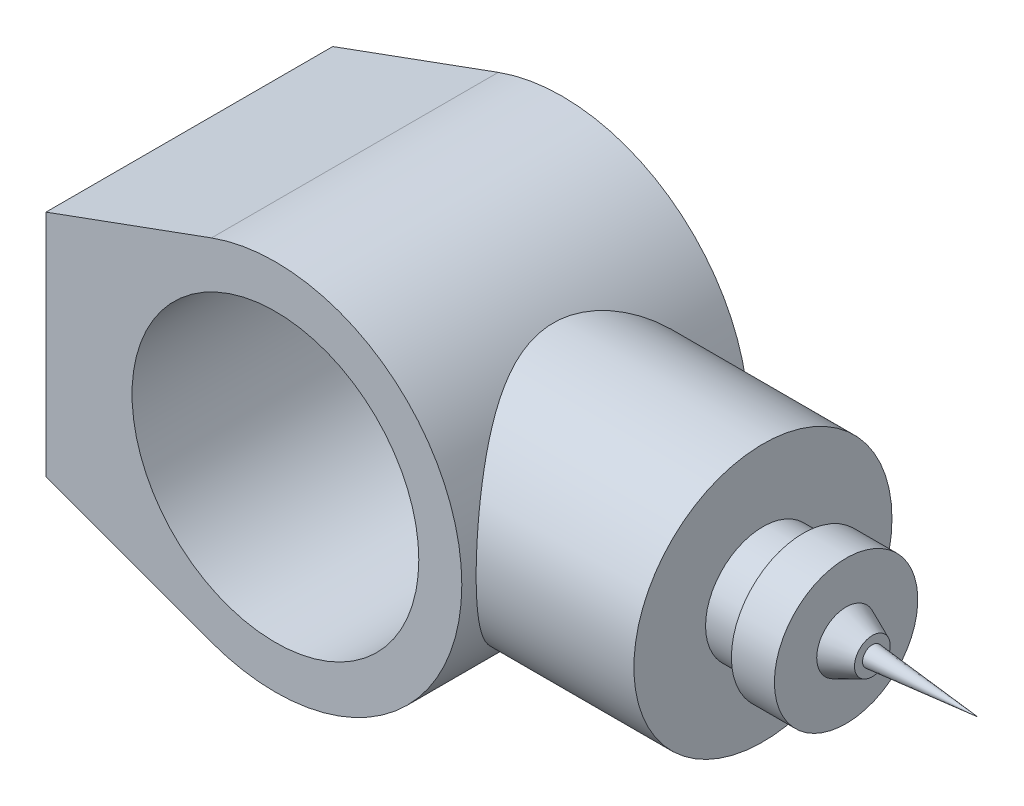
from build123d import *

# Parameters (mm, degrees)
SKETCH1_R                = 50
BOSS_EXTRUDE1_DEPTH      = 50
BOSS_EXTRUDE2_REACH      = 218.16
BOSS_EXTRUDE2_END_RADIUS = 65
SKETCH2_R                = 45


with BuildPart() as part:
    # Sketch1 → Boss-Extrude1 (new, symmetric)
    with BuildSketch(Plane.XY):
        with BuildLine():
            Line((-80, -40), (-80, 40))
            Line((-80, 40), (-22.281665693, 61.061668614))
            ThreePointArc((-22.281665693, 61.061668614), (65, 0), (-22.281665693, -61.061668614))
            Line((-22.281665693, -61.061668614), (-80, -40))
        make_face()
        Circle(SKETCH1_R, mode=Mode.SUBTRACT)
    extrude(amount=BOSS_EXTRUDE1_DEPTH, both=True)

    # Boss-Extrude2: up to this cylinder (the profile starts outside it)
    boss_extrude2_end = Plane(origin=(0, 0, 0), z_dir=(0, 0, -1)) * Cylinder(BOSS_EXTRUDE2_END_RADIUS, 567.32, mode=Mode.PRIVATE)
    # Sketch2 → Boss-Extrude2 (add, up to the surface)
    with BuildSketch(Plane(origin=(120, 0, 0), x_dir=(0, 0, -1), z_dir=(1, 0, 0)), mode=Mode.PRIVATE) as boss_extrude2_sk1:
        Circle(SKETCH2_R)
    boss_extrude2_tool1 = extrude(boss_extrude2_sk1.sketch, amount=-BOSS_EXTRUDE2_REACH, mode=Mode.PRIVATE) - boss_extrude2_end
    add(boss_extrude2_tool1.solids().sort_by_distance((120, 0, 0))[0])

    # Sketch3 → Revolve1 (revolve)
    with BuildSketch(Plane.XY, mode=Mode.PRIVATE) as revolve1_sk:
        Polygon((120, 0), (120, -20), (134, -20), (134, -25), (149, -25), (149, -10.24355852), (158.158462427, -6.228267003), (158.158462427, -3.420688422), (195, 0), align=None)
    revolve(revolve1_sk.sketch.rotate(Axis((0, 0, 0), (1, 0, 0)), 270), axis=Axis((0, 0, 0), (1, 0, 0)))


solid = part.part
